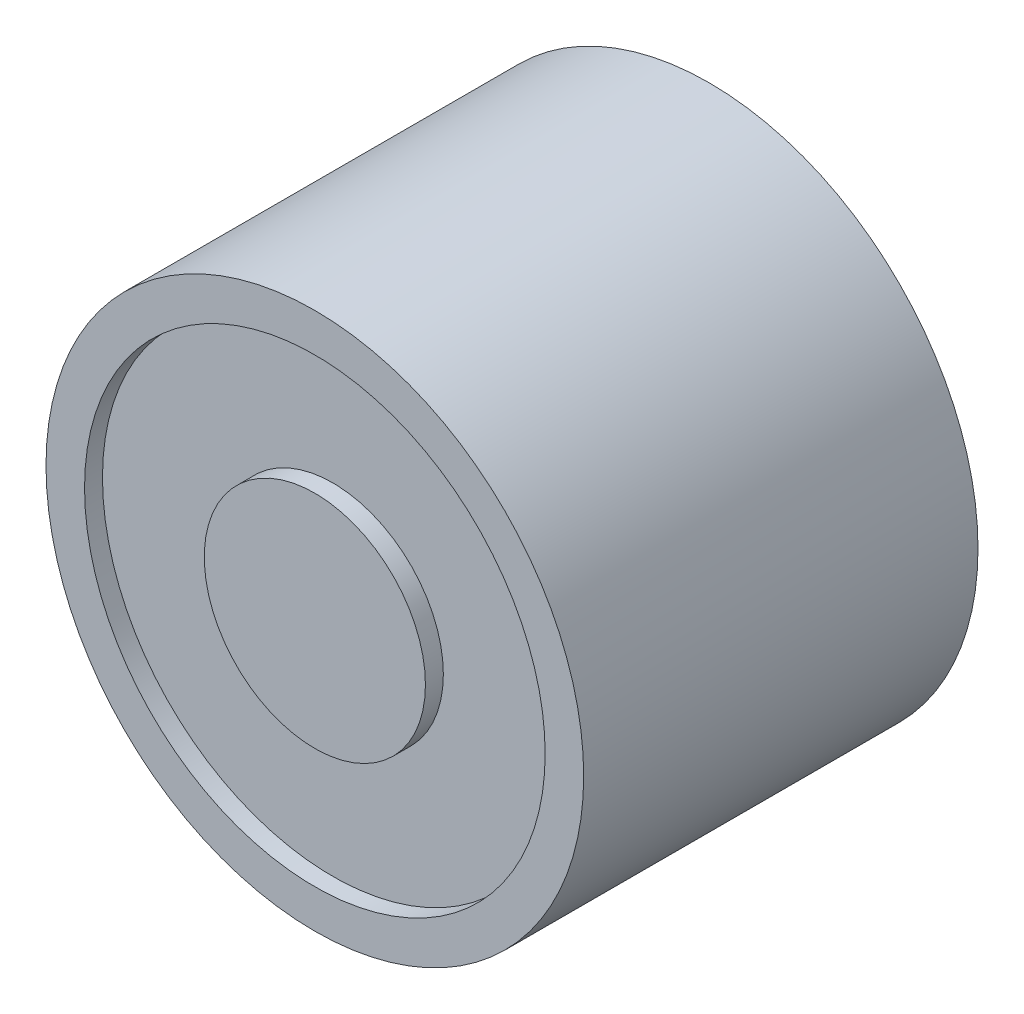
from build123d import *

# Parameters (mm, degrees)
SKETCH1_R           = 15
BOSS_EXTRUDE1_DEPTH = 22
SKETCH2_R           = 12.85
SKETCH2_R_2         = 6.17
CUT_EXTRUDE1_DEPTH  = 1


with BuildPart() as part:
    # Sketch1 → Boss-Extrude1 (new body)
    with BuildSketch(Plane.XY):
        Circle(SKETCH1_R)
    extrude(amount=BOSS_EXTRUDE1_DEPTH)

    # Sketch2 → Cut-Extrude1 (cut)
    with BuildSketch(Plane.XY.offset(22)):
        Circle(SKETCH2_R)
        Circle(SKETCH2_R_2, mode=Mode.SUBTRACT)
    extrude(amount=-CUT_EXTRUDE1_DEPTH, mode=Mode.SUBTRACT)


solid = part.part
